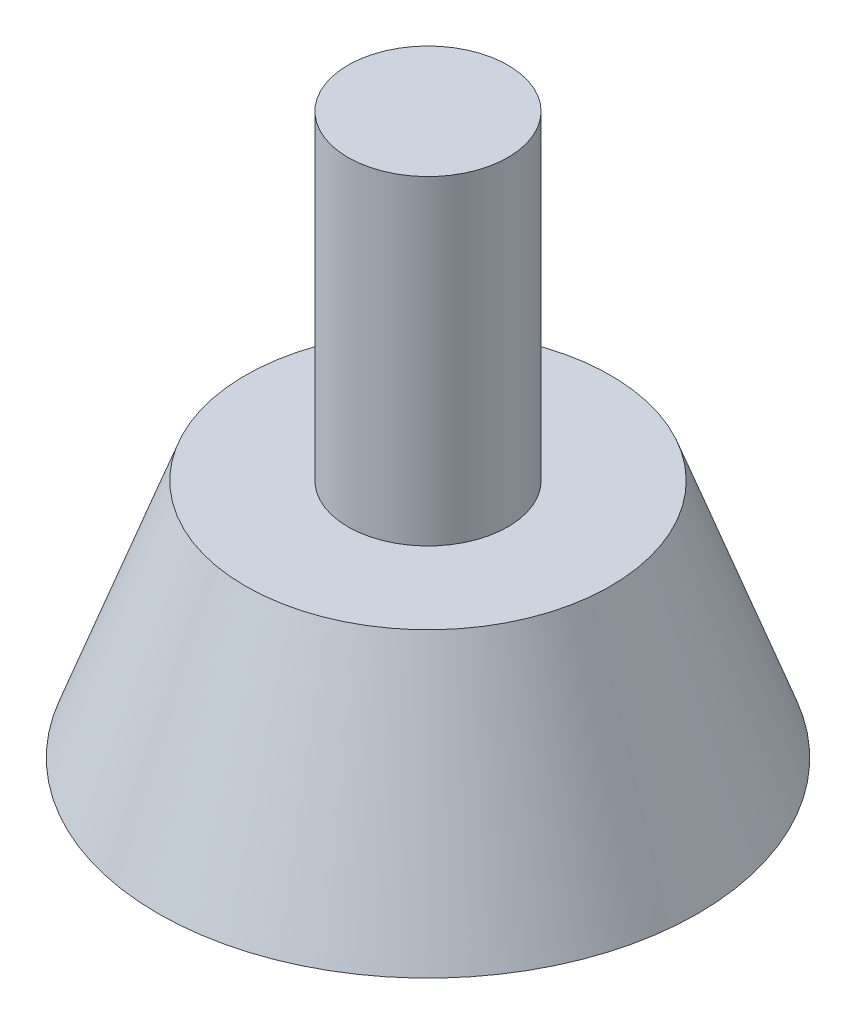
from build123d import *

# Parameters (mm, degrees)
SKETCH2_R           = 13.5
BOSS_EXTRUDE1_DEPTH = 12
BOSS_EXTRUDE1_TAPER = 20
SKETCH3_R           = 4
BOSS_EXTRUDE2_DEPTH = 16


with BuildPart() as part:
    # Sketch2 → Boss-Extrude1 (new body)
    with BuildSketch(Plane(origin=(0, 0, 0), x_dir=(1, 0, 0), z_dir=(0, 1, 0))):
        Circle(SKETCH2_R)
    extrude(amount=BOSS_EXTRUDE1_DEPTH, taper=BOSS_EXTRUDE1_TAPER)

    # Sketch3 → Boss-Extrude2 (add)
    with BuildSketch(Plane(origin=(0, 12, 0), x_dir=(1, 0, 0), z_dir=(0, 1, 0))):
        with Locations(Location((0, 0, 0), (0, 0, 270))):
            Circle(SKETCH3_R)
    extrude(amount=BOSS_EXTRUDE2_DEPTH)


solid = part.part
